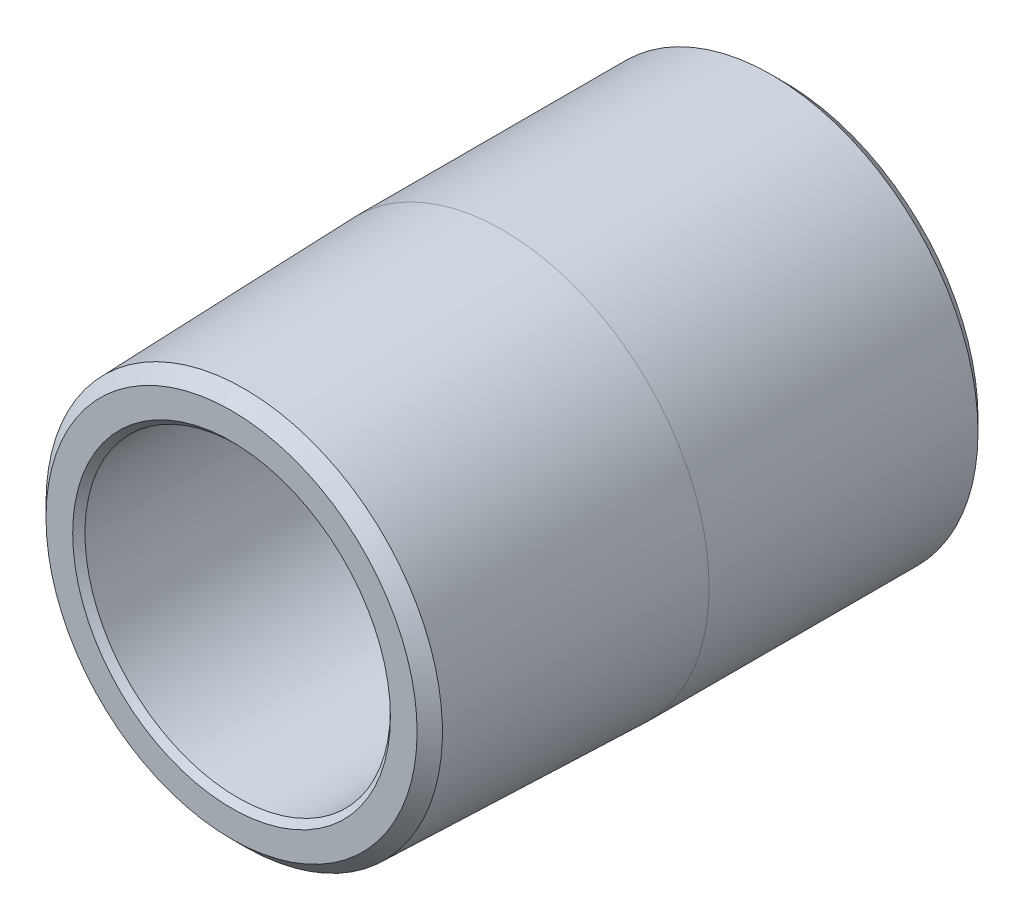
from build123d import *
from OCP.BRepFilletAPI import BRepFilletAPI_MakeChamfer

# Parameters (mm, degrees)
PIPESKETCH_R    = 10.668
PIPESKETCH_R_2  = 7.8994
EXTRUSION_DEPTH = 28.575
CHAMFER1_SIZE   = 0.635
CHAMFER1_SIZE2  = 0.655683131
CHAMFER2_SIZE   = 0.3175


with BuildPart() as part:
    # PipeSketch → Extrusion (new body)
    with BuildSketch(Plane.XY):
        Circle(PIPESKETCH_R)
        Circle(PIPESKETCH_R_2, mode=Mode.SUBTRACT)
    extrude(amount=EXTRUSION_DEPTH)

    # Sketch3 → Cut-Revolve1 (revolve, cut)
    with BuildSketch(Plane(origin=(0, 0, 0), x_dir=(0, 0, -1), z_dir=(1, 0, 0))):
        Polygon((-28.575, 10.668), (-28.575, 10.231882895), (-14.5415, 10.668), align=None)
    revolve(axis=Axis((0, 0, 0), (0, 0, 1)), mode=Mode.SUBTRACT)

    # Chamfer1: one chamfer whose edges measure the first distance from different faces: ONE call of the kernel's chamfer builder (chamfer() names one face for all edges)
    chamfer1_edges_1 = [part.edges().sort_by_distance(p)[0] for p in [
        (-10.668, 0, 0),
    ]]
    chamfer1_edges_2 = [part.edges().sort_by_distance(p)[0] for p in [
        (0, -10.231882895, 28.575),
    ]]
    chamfer1_side_2 = [part.faces().sort_by_distance(p)[0] for p in [
        (0, -9.942481544, 28.575),
    ]]
    chamfer1 = BRepFilletAPI_MakeChamfer(part.part.solid().wrapped)
    for e in chamfer1_edges_1:
        chamfer1.Add(CHAMFER1_SIZE, e.wrapped)
    for e in chamfer1_edges_2:
        chamfer1.Add(CHAMFER1_SIZE, CHAMFER1_SIZE2, e.wrapped, chamfer1_side_2[0].wrapped)  # the first distance lies on this face
    add(Compound.cast(chamfer1.Shape()), mode=Mode.REPLACE)

    # Chamfer2
    chamfer2_edges = [part.edges().sort_by_distance(p)[0] for p in [
        (-7.8994, 0, 28.575),
        (-7.8994, 0, 0),
    ]]
    chamfer(chamfer2_edges, length=CHAMFER2_SIZE)


solid = part.part
